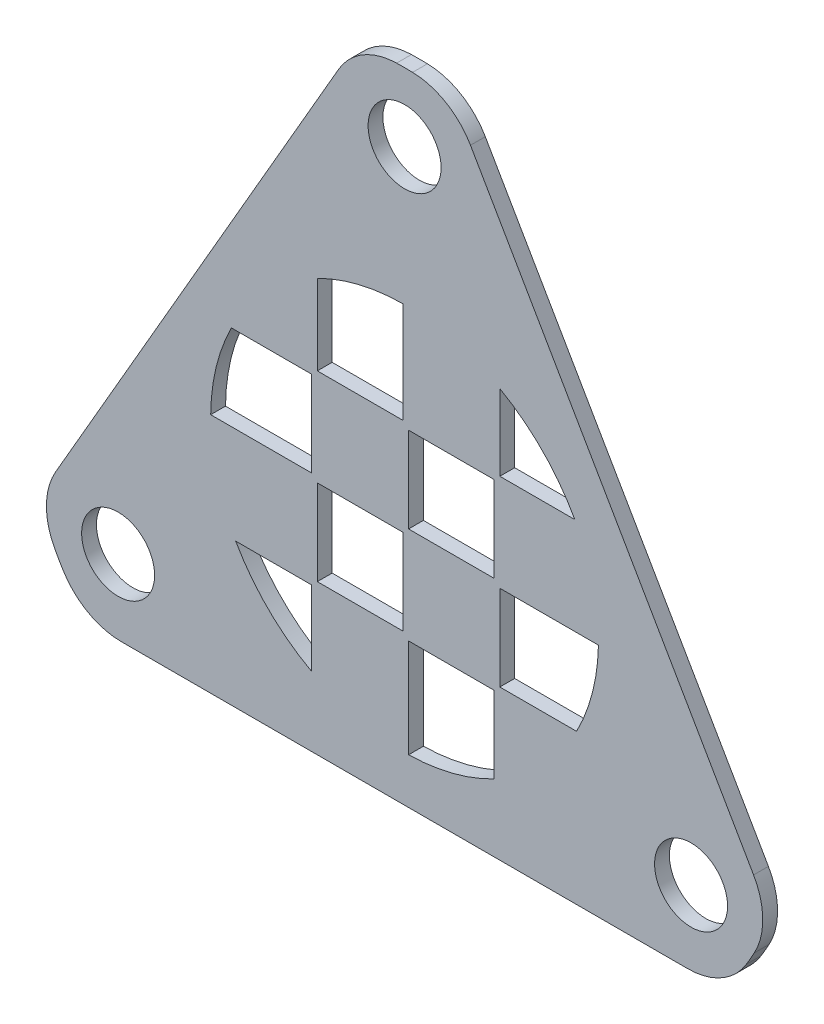
from build123d import *

# Parameters (mm, degrees)
SKETCH2_R               = 18
SKETCH2_W               = 7.5
SKETCH2_H               = 7.5
BOSS_EXTRUDE1_DEPTH     = 1.3
BOSS_EXTRUDE10_START    = 1.3
SKETCH18_W              = 7.7
SKETCH18_H              = 7.7
BOSS_EXTRUDE10_DEPTH    = 1.3
BOSS_EXTRUDE2_START     = -1.3
SKETCH3_R               = 35
SKETCH3_R_2             = 18
BOSS_EXTRUDE2_DEPTH     = 1.3
CUT_EXTRUDE1_DEPTH      = 50.514543318
CUT_EXTRUDE1_DEPTH_BACK = 50.514543318
SKETCH7_R               = 59.131365533
FILLET1_R               = 6
SKETCH4_R               = 3.2
CUT_EXTRUDE2_DEPTH      = 10


with BuildPart() as part:
    # Sketch2 → Boss-Extrude1 (new body)
    with BuildSketch(Plane.XY.offset(10)):
        Circle(SKETCH2_R)
        with BuildLine():
            Line((-8.15, -8.35), (-8.15, -14.91903147))
            ThreePointArc((-8.15, -14.91903147), (-11.939670478, -12.101415986), (-14.808021475, -8.35))
            Line((-14.808021475, -8.35), (-8.15, -8.35))
        make_face(mode=Mode.SUBTRACT)
        with BuildLine():
            Line((-8.15, -7.85), (-15.079041747, -7.85))
            ThreePointArc((-15.079041747, -7.85), (-16.470304718, -4.210589327), (-16.996396677, -0.35))
            Line((-16.996396677, -0.35), (-8.15, -0.35))
            Line((-8.15, -0.35), (-8.15, -7.85))
        make_face(mode=Mode.SUBTRACT)
        with BuildLine():
            Line((-8.15, 0.15), (-16.999338222, 0.15))
            ThreePointArc((-16.999338222, 0.15), (-16.521617742, 4.00451585), (-15.181485435, 7.65))
            Line((-15.181485435, 7.65), (-8.15, 7.65))
            Line((-8.15, 7.65), (-8.15, 0.15))
        make_face(mode=Mode.SUBTRACT)
        with BuildLine():
            Line((-8.15, 8.15), (-14.91903147, 8.15))
            ThreePointArc((-14.91903147, 8.15), (-12.02081528, 12.02081528), (-8.15, 14.91903147))
            Line((-8.15, 14.91903147), (-8.15, 8.15))
        make_face(mode=Mode.SUBTRACT)
        with BuildLine():
            Line((-7.65, 8.15), (-7.65, 15.181485435))
            ThreePointArc((-7.65, 15.181485435), (-4.00451585, 16.521617742), (-0.15, 16.999338222))
            Line((-0.15, 16.999338222), (-0.15, 8.15))
            Line((-0.15, 8.15), (-7.65, 8.15))
        make_face(mode=Mode.SUBTRACT)
        with BuildLine():
            Line((0.35, 8.15), (0.35, 16.996396677))
            ThreePointArc((0.35, 16.996396677), (4.210589327, 16.470304718), (7.85, 15.079041747))
            Line((7.85, 15.079041747), (7.85, 8.15))
            Line((7.85, 8.15), (0.35, 8.15))
        make_face(mode=Mode.SUBTRACT)
        with BuildLine():
            Line((8.35, 8.15), (8.35, 14.808021475))
            ThreePointArc((8.35, 14.808021475), (12.101415986, 11.939670478), (14.91903147, 8.15))
            Line((14.91903147, 8.15), (8.35, 8.15))
        make_face(mode=Mode.SUBTRACT)
        with BuildLine():
            Line((8.35, 7.65), (15.181485435, 7.65))
            ThreePointArc((15.181485435, 7.65), (16.521617742, 4.00451585), (16.999338222, 0.15))
            Line((16.999338222, 0.15), (8.35, 0.15))
            Line((8.35, 0.15), (8.35, 7.65))
        make_face(mode=Mode.SUBTRACT)
        with BuildLine():
            Line((8.35, -0.35), (16.996396677, -0.35))
            ThreePointArc((16.996396677, -0.35), (16.470304718, -4.210589327), (15.079041747, -7.85))
            Line((15.079041747, -7.85), (8.35, -7.85))
            Line((8.35, -7.85), (8.35, -0.35))
        make_face(mode=Mode.SUBTRACT)
        with BuildLine():
            Line((8.35, -8.35), (14.808021475, -8.35))
            ThreePointArc((14.808021475, -8.35), (12.02081528, -12.02081528), (8.35, -14.808021475))
            Line((8.35, -14.808021475), (8.35, -8.35))
        make_face(mode=Mode.SUBTRACT)
        with BuildLine():
            Line((7.85, -8.35), (7.85, -15.079041747))
            ThreePointArc((7.85, -15.079041747), (4.210589327, -16.470304718), (0.35, -16.996396677))
            Line((0.35, -16.996396677), (0.35, -8.35))
            Line((0.35, -8.35), (7.85, -8.35))
        make_face(mode=Mode.SUBTRACT)
        with BuildLine():
            Line((-0.15, -8.35), (-0.15, -16.999338222))
            ThreePointArc((-0.15, -16.999338222), (-4.00451585, -16.521617742), (-7.65, -15.181485435))
            Line((-7.65, -15.181485435), (-7.65, -8.35))
            Line((-7.65, -8.35), (-0.15, -8.35))
        make_face(mode=Mode.SUBTRACT)
        with Locations((-3.9, -4.1)):
            Rectangle(SKETCH2_W, SKETCH2_H, mode=Mode.SUBTRACT)
        with Locations((4.1, -4.1)):
            Rectangle(SKETCH2_W, SKETCH2_H, mode=Mode.SUBTRACT)
        with Locations((-3.9, 3.9)):
            Rectangle(SKETCH2_W, SKETCH2_H, mode=Mode.SUBTRACT)
        with Locations((4.1, 3.9)):
            Rectangle(SKETCH2_W, SKETCH2_H, mode=Mode.SUBTRACT)
    extrude(amount=-BOSS_EXTRUDE1_DEPTH)

    # Sketch18 → Boss-Extrude10 (add)
    with BuildSketch(Plane.XY.offset(8.7).offset(BOSS_EXTRUDE10_START)):
        with BuildLine():
            ThreePointArc((7.85, 15.079041747), (4.11362184, 16.494790552), (0.15, 16.999338222))
            Line((0.15, 16.999338222), (0.15, 8.15))
            Line((0.15, 8.15), (7.85, 8.15))
            Line((7.85, 8.15), (7.85, 15.079041747))
        make_face()
        with BuildLine():
            Line((8.15, 0.15), (16.999338222, 0.15))
            ThreePointArc((16.999338222, 0.15), (16.494790552, 4.11362184), (15.079041747, 7.85))
            Line((15.079041747, 7.85), (8.15, 7.85))
            Line((8.15, 7.85), (8.15, 0.15))
        make_face()
        with Locations((-4, 4)):
            Rectangle(SKETCH18_W, SKETCH18_H)
        with Locations((4, -4)):
            Rectangle(SKETCH18_W, SKETCH18_H)
        with BuildLine():
            Line((8.15, -8.15), (8.15, -14.91903147))
            ThreePointArc((8.15, -14.91903147), (12.02081528, -12.02081528), (14.91903147, -8.15))
            Line((14.91903147, -8.15), (8.15, -8.15))
        make_face()
        with BuildLine():
            Line((-7.85, -8.15), (-7.85, -15.079041747))
            ThreePointArc((-7.85, -15.079041747), (-4.11362184, -16.494790552), (-0.15, -16.999338222))
            Line((-0.15, -16.999338222), (-0.15, -8.15))
            Line((-0.15, -8.15), (-7.85, -8.15))
        make_face()
        with BuildLine():
            ThreePointArc((-16.999338222, -0.15), (-16.494790552, -4.11362184), (-15.079041747, -7.85))
            Line((-15.079041747, -7.85), (-8.15, -7.85))
            Line((-8.15, -7.85), (-8.15, -0.15))
            Line((-8.15, -0.15), (-16.999338222, -0.15))
        make_face()
        with BuildLine():
            ThreePointArc((-8.15, 14.91903147), (-12.02081528, 12.02081528), (-14.91903147, 8.15))
            Line((-14.91903147, 8.15), (-8.15, 8.15))
            Line((-8.15, 8.15), (-8.15, 14.91903147))
        make_face()
    extrude(amount=-BOSS_EXTRUDE10_DEPTH)

    # Sketch3 → Boss-Extrude2 (add)
    with BuildSketch(Plane(origin=(0, 0, 8.7), x_dir=(-1, 0, 0), z_dir=(0, 0, -1)).offset(BOSS_EXTRUDE2_START)):
        Circle(SKETCH3_R)
        Circle(SKETCH3_R_2, mode=Mode.SUBTRACT)
    extrude(amount=BOSS_EXTRUDE2_DEPTH)

    # Sketch7 → Cut-Extrude1 (cut, two sides: drawn at the far end of the back side and taken through both)
    with BuildSketch(Plane(origin=(0, 0, 8.7), x_dir=(-1, 0, 0), z_dir=(0, 0, -1)).offset(-CUT_EXTRUDE1_DEPTH_BACK)):
        Circle(SKETCH7_R)
        Polygon((0, 42), (-36.373066959, -21), (36.373066959, -21), align=None, mode=Mode.SUBTRACT)
    extrude(amount=CUT_EXTRUDE1_DEPTH + CUT_EXTRUDE1_DEPTH_BACK, mode=Mode.SUBTRACT)

    # Fillet1
    fillet1_edges = [part.edges().sort_by_distance(p)[0] for p in [
        (4.186533479, 34.748711306, 9.35),
        (32.186533479, -13.748711306, 9.35),
        (28, -21, 9.35),
        (-28, -21, 9.35),
        (-32.186533479, -13.748711306, 9.35),
        (-4.186533479, 34.748711306, 9.35),
    ]]
    fillet(fillet1_edges, radius=FILLET1_R)

    # Sketch4 → Cut-Extrude2 (cut)
    with BuildSketch(Plane(origin=(0, 0, 8.7), x_dir=(-1, 0, 0), z_dir=(0, 0, -1))):
        with Locations((0, 29)):
            Circle(SKETCH4_R)
        with Locations((25.11473671, -14.5)):
            Circle(SKETCH4_R)
        with Locations((-25.11473671, -14.5)):
            Circle(SKETCH4_R)
    extrude(amount=-CUT_EXTRUDE2_DEPTH, mode=Mode.SUBTRACT)


solid = part.part
